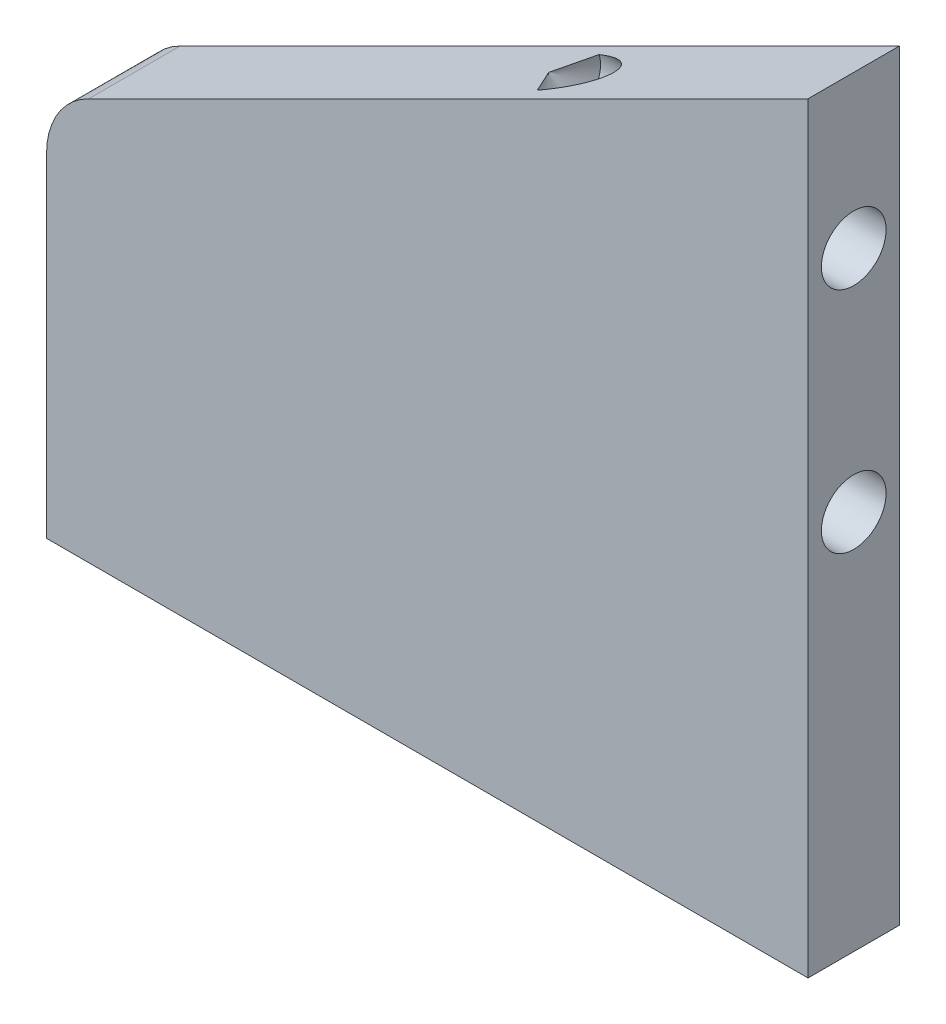
from build123d import *

# Parameters (mm, degrees)
AUFSATZ_LINEAR_AUSTRAGEN1_DEPTH = 12
M10_GEWINDEBOHRUNG1_D           = 8.5
M10_GEWINDEBOHRUNG1_DEPTH       = 37.5
M10_GEWINDEBOHRUNG1_TIP         = 2.553657631
M10_GEWINDEBOHRUNG2_D           = 8.5
M10_GEWINDEBOHRUNG2_DEPTH       = 37.5
M10_GEWINDEBOHRUNG2_TIP         = 2.553657631
VERRUNDUNG1_R                   = 10


with BuildPart() as part:
    # Skizze1 → Aufsatz-Linear austragen1 (new body)
    with BuildSketch(Plane.XY):
        Polygon((100, 0), (100, 100), (0, 50), (0, 0), align=None)
    extrude(amount=AUFSATZ_LINEAR_AUSTRAGEN1_DEPTH)

    # M10 Gewindebohrung1
    with Locations(Plane(origin=(0, 0, 0), x_dir=(-1, 0, 0), z_dir=(0, -1, 0))):
        with Locations((-15, -6), (-85, -6)):
            Hole(M10_GEWINDEBOHRUNG1_D / 2, depth=M10_GEWINDEBOHRUNG1_DEPTH)
            with Locations((0, 0, -(M10_GEWINDEBOHRUNG1_DEPTH + M10_GEWINDEBOHRUNG1_TIP / 2))):  # 118° drill point
                Cone(0, M10_GEWINDEBOHRUNG1_D / 2, M10_GEWINDEBOHRUNG1_TIP, mode=Mode.SUBTRACT)

    # M10 Gewindebohrung2
    with Locations(Plane(origin=(100, 0, 0), x_dir=(0, 0, -1), z_dir=(1, 0, 0))):
        with Locations((-6, 50), (-6, 80)):
            Hole(M10_GEWINDEBOHRUNG2_D / 2, depth=M10_GEWINDEBOHRUNG2_DEPTH)
            with Locations((0, 0, -(M10_GEWINDEBOHRUNG2_DEPTH + M10_GEWINDEBOHRUNG2_TIP / 2))):  # 118° drill point
                Cone(0, M10_GEWINDEBOHRUNG2_D / 2, M10_GEWINDEBOHRUNG2_TIP, mode=Mode.SUBTRACT)

    # Verrundung1
    verrundung1_edges = [part.edges().sort_by_distance(p)[0] for p in [
        (0, 50, 6),
    ]]
    fillet(verrundung1_edges, radius=VERRUNDUNG1_R)


solid = part.part
